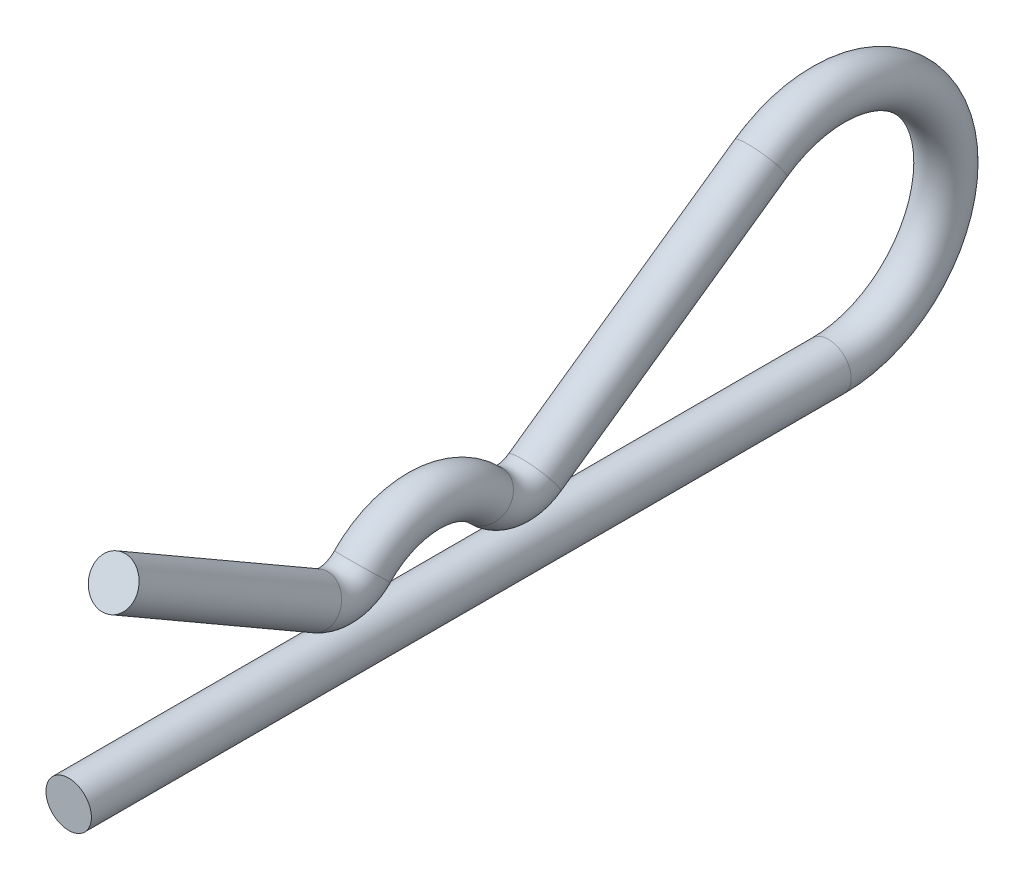
from build123d import *

# Parameters (mm, degrees)
SKETCH3_R = 0.381


with BuildPart() as part:
    # Sweep1: sweep along a path in Sketch4
    with BuildLine(Plane(origin=(0, 0, 0), x_dir=(0, 0, -1), z_dir=(1, 0, 0))) as sweep1_path:
        Line((-6.78942, 0.870570192), (-3.394217856, -1.089650679))
        ThreePointArc((-3.394217856, -1.089650679), (-2.987318885, -1.1684), (-2.618502629, -0.979342342))
        ThreePointArc((-2.618502629, -0.979342342), (-1.5875, -0.539724548), (-0.556497371, -0.979342342))
        ThreePointArc((-0.556497371, -0.979342342), (-0.159498585, -1.17176691), (0.267049156, -1.059106914))
        Line((0.267049156, -1.059106914), (4.061772971, 1.610085333))
        ThreePointArc((4.061772971, 1.610085333), (7.071058539, 0.593944135), (5.1943, -1.9685))
        Line((5.1943, -1.9685), (-7.5438, -1.9685))
    # Sketch3 → Sweep1 (sweep)
    with BuildSketch(Plane.XY.offset(7.5438)):
        with Locations((0, -1.9685)):
            Circle(SKETCH3_R)
    sweep(path=sweep1_path.line)


solid = part.part
